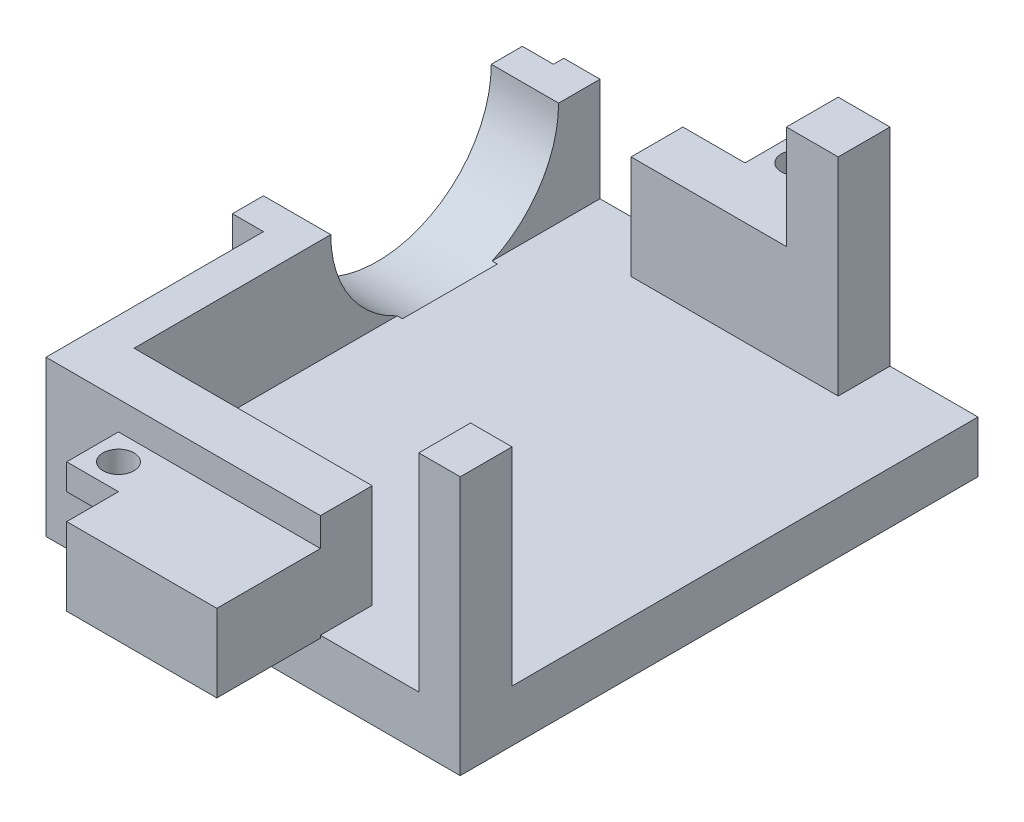
from build123d import *

# Parameters (mm, degrees)
SKETCH1_W            = 40
SKETCH1_H            = 50
BOSS_EXTRUDE1_DEPTH  = 5
SKETCH3_W            = 5
SKETCH3_H            = 5
SKETCH3_W_2          = 4
BOSS_EXTRUDE5_DEPTH  = 20
SKETCH3_3_W          = 15
SKETCH3_3_H          = 5
BOSS_EXTRUDE6_DEPTH  = 10
CUT_EXTRUDE3_DEPTH   = 4
BOSS_EXTRUDE9_START  = 3
BOSS_EXTRUDE9_DEPTH  = 3
SKETCH12_W           = 5
SKETCH12_H           = 5
BOSS_EXTRUDE10_DEPTH = 5
SKETCH13_R           = 1.5
CUT_EXTRUDE4_DEPTH   = 5
SKETCH16_W           = 5
SKETCH16_H           = 2.5
BOSS_EXTRUDE13_DEPTH = 5
BOSS_EXTRUDE14_DEPTH = 10
SKETCH17_R           = 1.5
CUT_EXTRUDE6_DEPTH   = 2.5


with BuildPart() as part:
    # Sketch1 → Boss-Extrude1 (new body)
    with BuildSketch(Plane(origin=(0, 0, 0), x_dir=(1, 0, 0), z_dir=(0, 1, 0))):
        Rectangle(SKETCH1_W, SKETCH1_H)
    extrude(amount=BOSS_EXTRUDE1_DEPTH)

    # Sketch3 → Boss-Extrude5 (add)
    with BuildSketch(Plane(origin=(0, 5, 0), x_dir=(1, 0, 0), z_dir=(0, 1, 0))):
        with Locations((9, 22.5)):
            Rectangle(SKETCH3_W, SKETCH3_H)
        with Locations((18, -22.5)):
            Rectangle(SKETCH3_W_2, SKETCH3_H)
    extrude(amount=BOSS_EXTRUDE5_DEPTH)

    # Sketch3<3> → Boss-Extrude6 (add)
    with BuildSketch(Plane(origin=(0, 5, 0), x_dir=(1, 0, 0), z_dir=(0, 1, 0))):
        with Locations((-1, 22.5)):
            Rectangle(SKETCH3_3_W, SKETCH3_3_H)
        Polygon((-16.5, -20), (-16.5, 25), (-20, 25), (-20, -25), (6.5, -25), (6.5, -20), align=None)
    extrude(amount=BOSS_EXTRUDE6_DEPTH)

    # Sketch8 → Cut-Extrude3 (cut)
    with BuildSketch(Plane.ZY.offset(20)):
        with BuildLine():
            Line((1, 15), (-21, 15))
            ThreePointArc((-21, 15), (-10, 4), (1, 15))
        make_face()
    extrude(amount=-CUT_EXTRUDE3_DEPTH, mode=Mode.SUBTRACT)

    # Sketch10 → Boss-Extrude9 (add)
    with BuildSketch(Plane.ZY.offset(20).offset(BOSS_EXTRUDE9_START)):
        with BuildLine():
            Line((1, 15), (4, 15))
            Line((4, 15), (4, 0))
            Line((4, 0), (-24, 0))
            Line((-24, 0), (-24, 15))
            Line((-24, 15), (-21, 15))
            ThreePointArc((-21, 15), (-10, 4), (1, 15))
        make_face()
    extrude(amount=-BOSS_EXTRUDE9_DEPTH)

    # Sketch12 → Boss-Extrude10 (add)
    with BuildSketch(Plane(origin=(0, 0, -25), x_dir=(-1, 0, 0), z_dir=(0, 0, -1))):
        with Locations((0, 12.5)):
            Rectangle(SKETCH12_W, SKETCH12_H)
    extrude(amount=BOSS_EXTRUDE10_DEPTH)

    # Sketch13 → Cut-Extrude4 (cut)
    with BuildSketch(Plane.XZ.offset(-10)):
        with Locations((0, -27.5)):
            Circle(SKETCH13_R)
    extrude(amount=-CUT_EXTRUDE4_DEPTH, mode=Mode.SUBTRACT)

    # Sketch16 → Boss-Extrude13 (add)
    with BuildSketch(Plane.XY.offset(25)):
        with Locations((-10.5, 11)):
            Rectangle(SKETCH16_W, SKETCH16_H)
    extrude(amount=BOSS_EXTRUDE13_DEPTH)

    # Sketch16<3> → Boss-Extrude14 (add)
    with BuildSketch(Plane.XY.offset(25)):
        Polygon((-8, 4.75), (6.5, 4.75), (6.5, 5), (6.5, 12.25), (-8, 12.25), (-8, 9.75), align=None)
    extrude(amount=BOSS_EXTRUDE14_DEPTH)

    # Sketch17 → Cut-Extrude6 (cut)
    with BuildSketch(Plane.XZ.offset(-9.75)):
        with Locations((-10.5, 27.5)):
            Circle(SKETCH17_R)
    extrude(amount=-CUT_EXTRUDE6_DEPTH, mode=Mode.SUBTRACT)


solid = part.part
